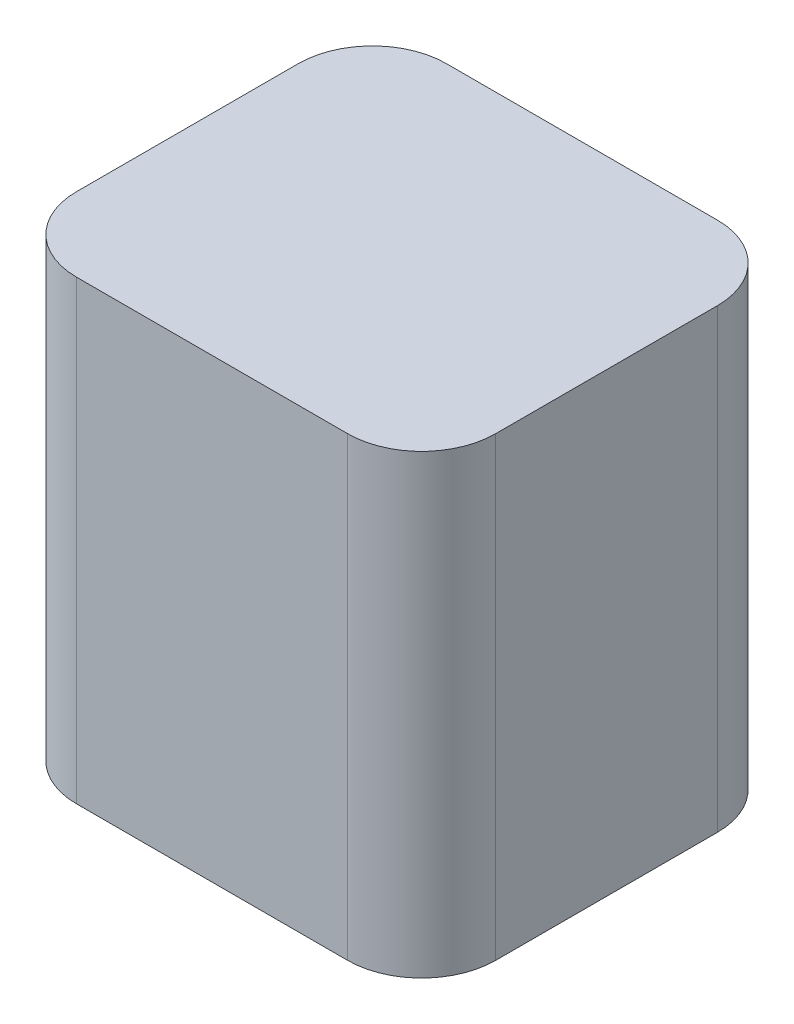
from build123d import *

# Parameters (mm, degrees)
SKETCH1_W           = 863.6
SKETCH1_H           = 762
BOSS_EXTRUDE1_DEPTH = 939.8
FILLET1_R           = 152.4


with BuildPart() as part:
    # Sketch1 → Boss-Extrude1 (new body)
    with BuildSketch(Plane(origin=(0, 0, 0), x_dir=(1, 0, 0), z_dir=(0, 1, 0))):
        Rectangle(SKETCH1_W, SKETCH1_H)
    extrude(amount=BOSS_EXTRUDE1_DEPTH)

    # Fillet1
    fillet1_edges = [part.edges().sort_by_distance(p)[0] for p in [
        (431.8, 469.9, 381),
        (-431.8, 469.9, 381),
        (-431.8, 469.9, -381),
        (431.8, 469.9, -381),
    ]]
    fillet(fillet1_edges, radius=FILLET1_R)


solid = part.part
